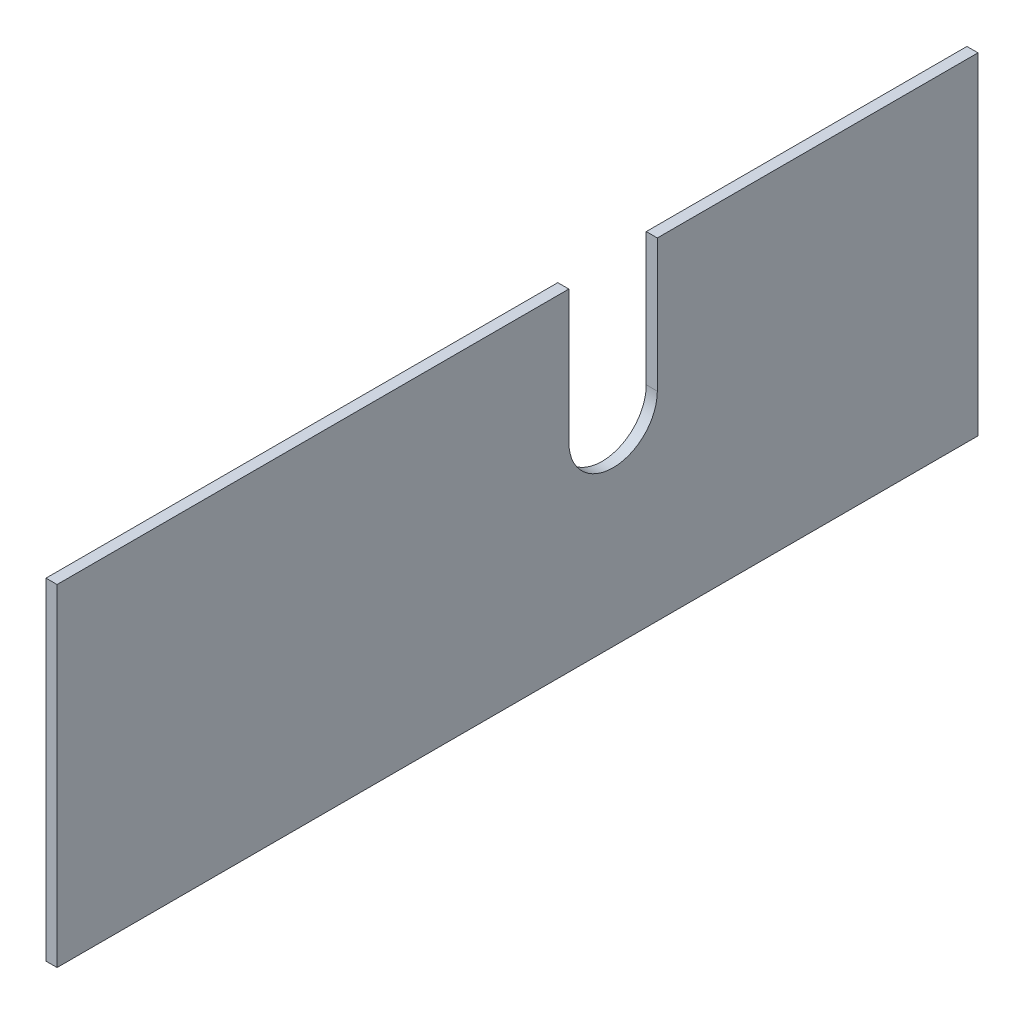
from build123d import *

# Parameters (mm, degrees)
SKETCH1_W           = 83.28
SKETCH1_H           = 30
BOSS_EXTRUDE1_DEPTH = 1
CUT_EXTRUDE2_DEPTH  = 45.270640384


with BuildPart() as part:
    # Sketch1 → Boss-Extrude1 (new body)
    with BuildSketch(Plane(origin=(0, 0, 0), x_dir=(0, 0, -1), z_dir=(1, 0, 0))):
        Rectangle(SKETCH1_W, SKETCH1_H)
    extrude(amount=BOSS_EXTRUDE1_DEPTH)

    # Sketch3 → Cut-Extrude2 (cut, through all)
    with BuildSketch(Plane(origin=(1, 0, 0), x_dir=(0, 0, -1), z_dir=(1, 0, 0))):
        with BuildLine():
            Line((4.64, 15), (4.64, 3))
            ThreePointArc((4.64, 3), (8.64, 7), (12.64, 3))
            Line((12.64, 3), (12.64, 15))
            Line((12.64, 15), (4.64, 15))
        make_face()
        with BuildLine():
            ThreePointArc((12.64, 3), (8.64, 7), (4.64, 3))
            Line((4.64, 3), (12.64, 3))
        make_face()
        with BuildLine():
            Line((12.64, 3), (4.64, 3))
            ThreePointArc((4.64, 3), (8.64, -1), (12.64, 3))
        make_face()
    extrude(amount=-CUT_EXTRUDE2_DEPTH, mode=Mode.SUBTRACT)


solid = part.part
